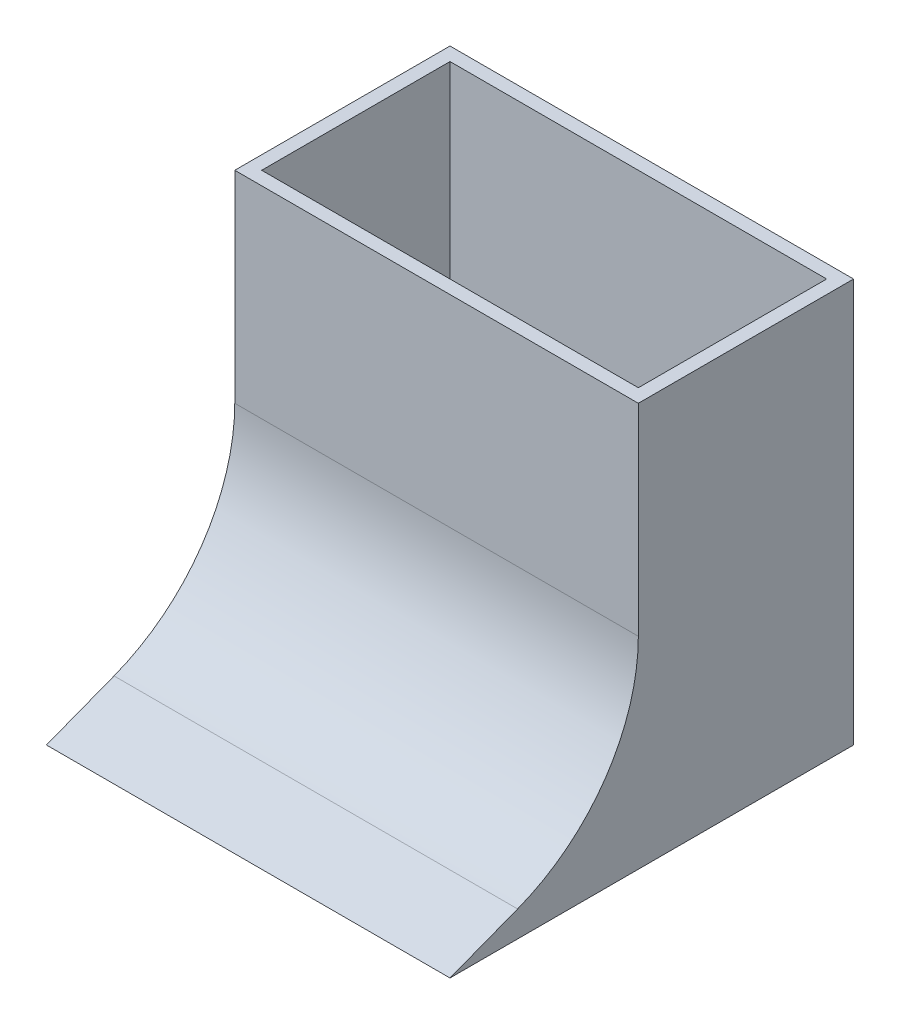
from build123d import *

# Parameters (mm, degrees)
ESBO_O1_W                  = 90
ESBO_O1_H                  = 90
ESBO_O1_W_2                = 84
ESBO_O1_H_2                = 84
EXTRUS_O_FINA2_DEPTH       = 45
CORTE_EXTRUS_O1_DEPTH      = 78.942286341
CORTE_EXTRUS_O1_DEPTH_BACK = 78.942286341
ESBO_O5_W                  = 3
ESBO_O5_H                  = 84
ESBO_O7_R                  = 45
ESBO_O7_R_2                = 42
EXTRUS_O_FINA4_DEPTH       = 45
CORTE_EXTRUS_O2_DEPTH      = 111.227038425
CORTE_EXTRUS_O2_DEPTH_BACK = 111.227038425
ESBO_O9_W                  = 3
ESBO_O9_H                  = 45
RESSALTO_EXTRUS_O1_DEPTH   = 45
ESBO_O10_W                 = 3
ESBO_O10_H                 = 90
RESSALTO_EXTRUS_O2_DEPTH   = 45
ESBO_O11_W                 = 3
ESBO_O11_H                 = 90
RESSALTO_EXTRUS_O3_DEPTH   = 45
CORTE_EXTRUS_O4_DEPTH      = 78.942286341
CORTE_EXTRUS_O4_DEPTH_BACK = 78.942286341
CORTE_EXTRUS_O5_DEPTH      = 78.942286341
CORTE_EXTRUS_O5_DEPTH_BACK = 78.942286341
ESBO_O14_R                 = 42
CORTE_EXTRUS_O6_DEPTH      = 78.942286341
CORTE_EXTRUS_O6_DEPTH_BACK = 78.942286341
ESBO_O16_W                 = 84
ESBO_O16_H                 = 42
CORTE_EXTRUS_O8_DEPTH      = 78.942286341


with BuildPart() as part:
    # Esboço1 → Extrusão-Fina2 (new, symmetric)
    with BuildSketch(Plane(origin=(0, 0, 0), x_dir=(0, 0, -1), z_dir=(1, 0, 0))):
        Rectangle(ESBO_O1_W, ESBO_O1_H)
        Rectangle(ESBO_O1_W_2, ESBO_O1_H_2, mode=Mode.SUBTRACT)
    extrude(amount=EXTRUS_O_FINA2_DEPTH, both=True)

    # Esboço5 → Corte-extrusão1 (cut, two sides: drawn at the far end of the back side and taken through both)
    with BuildSketch(Plane(origin=(0, 0, 0), x_dir=(0, 0, -1), z_dir=(1, 0, 0)).offset(-CORTE_EXTRUS_O1_DEPTH_BACK)):
        with Locations((-43.5, 0)):
            Rectangle(ESBO_O5_W, ESBO_O5_H)
    extrude(amount=CORTE_EXTRUS_O1_DEPTH + CORTE_EXTRUS_O1_DEPTH_BACK, mode=Mode.SUBTRACT)

    # Esboço7 → Extrusão-Fina4 (add, symmetric)
    with BuildSketch(Plane(origin=(0, 0, 0), x_dir=(0, 0, -1), z_dir=(1, 0, 0))):
        with Locations((-45, 0)):
            Circle(ESBO_O7_R)
        with Locations((-45, 0)):
            Circle(ESBO_O7_R_2, mode=Mode.SUBTRACT)
    extrude(amount=EXTRUS_O_FINA4_DEPTH, both=True)

    # Esboço8 → Corte-extrusão2 (cut, two sides: drawn at the far end of the back side and taken through both)
    with BuildSketch(Plane(origin=(0, 0, 0), x_dir=(0, 0, -1), z_dir=(1, 0, 0)).offset(-CORTE_EXTRUS_O2_DEPTH_BACK)):
        Polygon((-45, -45), (-29.921616549, -39.200030007), (-3, 0), (-3, 45), (-95.371690307, 45), (-95.371690307, -45), align=None)
    extrude(amount=CORTE_EXTRUS_O2_DEPTH + CORTE_EXTRUS_O2_DEPTH_BACK, mode=Mode.SUBTRACT)

    # Esboço9 → Ressalto-extrusão1 (add, symmetric)
    with BuildSketch(Plane(origin=(0, 0, 0), x_dir=(0, 0, -1), z_dir=(1, 0, 0))):
        with Locations((-1.5, 22.5)):
            Rectangle(ESBO_O9_W, ESBO_O9_H)
    extrude(amount=RESSALTO_EXTRUS_O1_DEPTH, both=True)

    # Esboço10 → Ressalto-extrusão2 (add, symmetric)
    with BuildSketch(Plane(origin=(0, 0, 0), x_dir=(1, 0, 0), z_dir=(0, 1, 0))):
        with Locations((-43.5, 0)):
            Rectangle(ESBO_O10_W, ESBO_O10_H)
    extrude(amount=RESSALTO_EXTRUS_O2_DEPTH, both=True)

    # Esboço11 → Ressalto-extrusão3 (add, symmetric)
    with BuildSketch(Plane(origin=(0, 0, 0), x_dir=(1, 0, 0), z_dir=(0, 1, 0))):
        with Locations((43.5, 0)):
            Rectangle(ESBO_O11_W, ESBO_O11_H)
    extrude(amount=RESSALTO_EXTRUS_O3_DEPTH, both=True)

    # Esboço13 → Corte-extrusão4 (cut, two sides: drawn at the far end of the back side and taken through both)
    with BuildSketch(Plane(origin=(0, 0, 0), x_dir=(0, 0, -1), z_dir=(1, 0, 0)).offset(-CORTE_EXTRUS_O4_DEPTH_BACK)):
        Polygon((-3, 0), (-3, 45), (-45, 45), (-45, -45), align=None)
    extrude(amount=CORTE_EXTRUS_O4_DEPTH + CORTE_EXTRUS_O4_DEPTH_BACK, mode=Mode.SUBTRACT)

    # Esboço14 → Corte-extrusão5 (cut, two sides: drawn at the far end of the back side and taken through both)
    with BuildSketch(Plane(origin=(0, 0, 0), x_dir=(0, 0, -1), z_dir=(1, 0, 0)).offset(-CORTE_EXTRUS_O5_DEPTH_BACK)):
        with Locations((-45, 0)):
            Circle(ESBO_O14_R)
    extrude(amount=CORTE_EXTRUS_O5_DEPTH + CORTE_EXTRUS_O5_DEPTH_BACK, mode=Mode.SUBTRACT)

    # Esboço15 → Corte-extrusão6 (cut, two sides: drawn at the far end of the back side and taken through both)
    with BuildSketch(Plane(origin=(0, 0, 0), x_dir=(0, 0, -1), z_dir=(1, 0, 0)).offset(-CORTE_EXTRUS_O6_DEPTH_BACK)):
        Polygon((-45, -45), (-29.921616549, -39.200030007), (-45.529383671, 1.376024306), align=None)
    extrude(amount=CORTE_EXTRUS_O6_DEPTH + CORTE_EXTRUS_O6_DEPTH_BACK, mode=Mode.SUBTRACT)

    # Esboço16 → Corte-extrusão8 (cut, through all)
    with BuildSketch(Plane(origin=(0, 0, 0), x_dir=(1, 0, 0), z_dir=(0, 1, 0))):
        with Locations((0, 21)):
            Rectangle(ESBO_O16_W, ESBO_O16_H)
    extrude(amount=CORTE_EXTRUS_O8_DEPTH, mode=Mode.SUBTRACT)


solid = part.part
